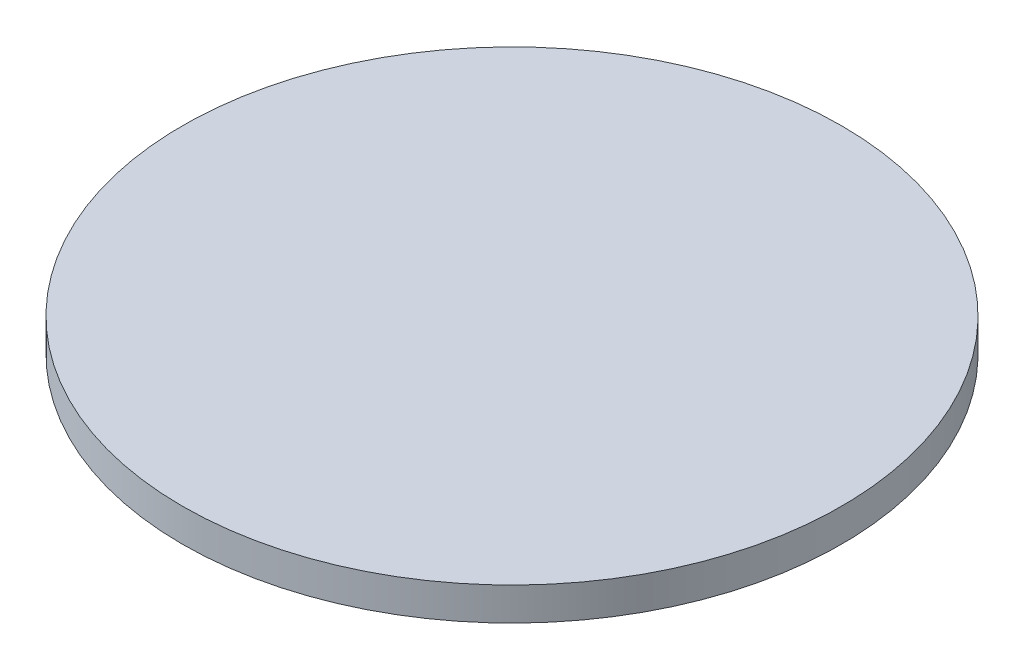
from build123d import *

# Parameters (mm, degrees)
SKETCH1_R           = 5
BOSS_EXTRUDE1_DEPTH = 0.5


with BuildPart() as part:
    # Sketch1 → Boss-Extrude1 (new body)
    with BuildSketch(Plane(origin=(0, 0, 0), x_dir=(1, 0, 0), z_dir=(0, 1, 0))):
        with Locations(Location((0, 0, 0), (0, 0, 270))):
            Circle(SKETCH1_R)
    extrude(amount=BOSS_EXTRUDE1_DEPTH)


solid = part.part
